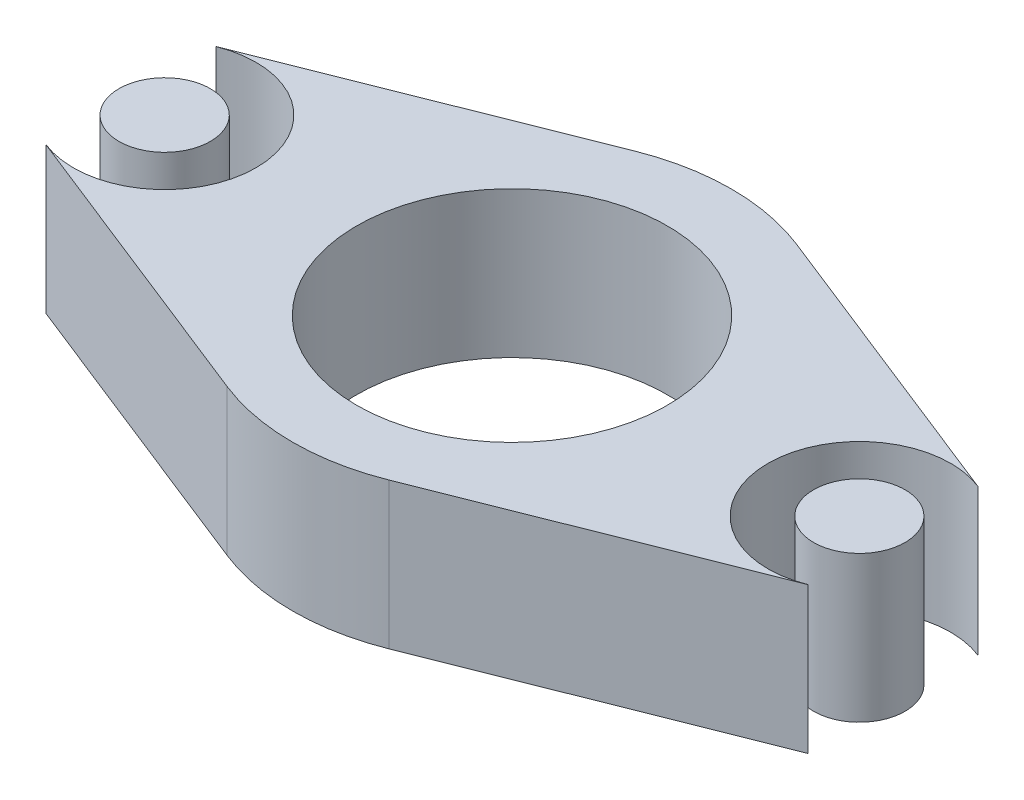
from build123d import *

# Parameters (mm, degrees)
SKETCH2_R             = 42.5
BOSS_EXTRUDE1_DEPTH   = 40
SKETCH2_R_2           = 12.5
BOSS_EXTRUDE1_2_DEPTH = 40
BOSS_EXTRUDE1_3_DEPTH = 40


with BuildPart() as part:
    # Sketch2 → Boss-Extrude1 (new body)
    with BuildSketch(Plane(origin=(0, 0, 0), x_dir=(1, 0, 0), z_dir=(0, 1, 0))):
        with BuildLine():
            Line((-104.210526316, -23.241475964), (-22.105263158, -55.779542314))
            ThreePointArc((-22.105263158, -55.779542314), (0, -60), (22.105263158, -55.779542314))
            Line((22.105263158, -55.779542314), (104.210526316, -23.241475964))
            ThreePointArc((104.210526316, -23.241475964), (70, 0), (104.210526316, 23.241475964))
            Line((104.210526316, 23.241475964), (22.105263158, 55.779542314))
            ThreePointArc((22.105263158, 55.779542314), (0, 60), (-22.105263158, 55.779542314))
            Line((-22.105263158, 55.779542314), (-104.210526316, 23.241475964))
            ThreePointArc((-104.210526316, 23.241475964), (-70, 0), (-104.210526316, -23.241475964))
        make_face()
        with Locations(Location((0, 0, 0), (0, 0, 270))):
            Circle(SKETCH2_R, mode=Mode.SUBTRACT)
    extrude(amount=BOSS_EXTRUDE1_DEPTH)


with BuildPart() as body_2:
    # Sketch2 → Boss-Extrude1 2 (new body)
    with BuildSketch(Plane(origin=(0, 0, 0), x_dir=(1, 0, 0), z_dir=(0, 1, 0))):
        with Locations(Location((-95, 0, 0), (0, 0, 270))):
            Circle(SKETCH2_R_2)
    extrude(amount=BOSS_EXTRUDE1_2_DEPTH)


with BuildPart() as body_3:
    # Sketch2 → Boss-Extrude1 3 (new body)
    with BuildSketch(Plane(origin=(0, 0, 0), x_dir=(1, 0, 0), z_dir=(0, 1, 0))):
        with Locations(Location((95, 0, 0), (0, 0, 270))):
            Circle(SKETCH2_R_2)
    extrude(amount=BOSS_EXTRUDE1_3_DEPTH)


solid = Compound([part.part, body_2.part, body_3.part])
